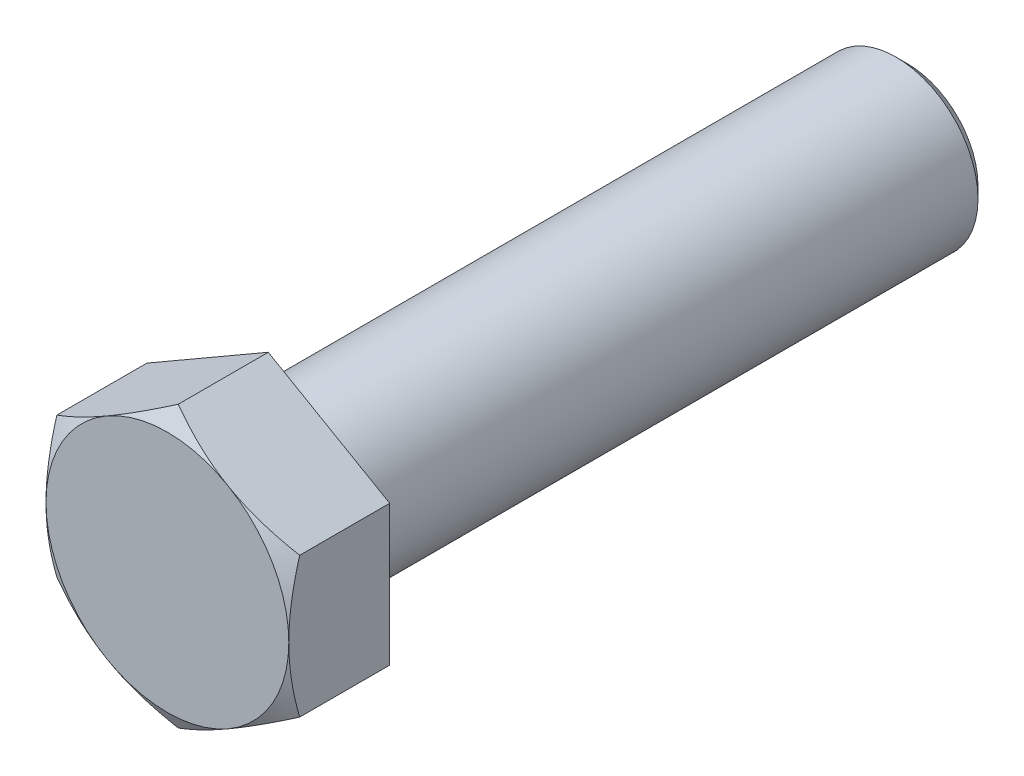
from build123d import *

# Parameters (mm, degrees)
BOSS_EXTRUDE1_DEPTH = 11.28


with BuildPart() as part:
    # Sketch1 → Boss-Extrude1 (new body)
    with BuildSketch(Plane.XY):
        Polygon((0, 15.397931679), (-13.335, 7.69896584), (-13.335, -7.69896584), (0, -15.397931679), (13.335, -7.69896584), (13.335, 7.69896584), align=None)
    extrude(amount=BOSS_EXTRUDE1_DEPTH)

    # Sketch2 → Revolve1 (revolve)
    with BuildSketch(Plane(origin=(0, 0, 0), x_dir=(0, 0, -1), z_dir=(1, 0, 0)), mode=Mode.PRIVATE) as revolve1_sk:
        with BuildLine():
            Line((0, 0), (0, 9.6))
            ThreePointArc((0, 9.6), (0.175735931, 9.175735931), (0.6, 9))
            Line((0.6, 9), (68.75, 9))
            Line((68.75, 9), (70, 7.75))
            Line((70, 7.75), (70, 0))
            Line((70, 0), (0, 0))
        make_face()
    revolve(revolve1_sk.sketch.rotate(Axis((0, 0, 0), (0, 0, -1)), 90), axis=Axis((0, 0, 0), (0, 0, -1)))

    # Sketch3 → Cut-Revolve1 (revolve, cut)
    with BuildSketch(Plane(origin=(0, 0, 0), x_dir=(0, 0, -1), z_dir=(1, 0, 0)), mode=Mode.PRIVATE) as cut_revolve1_sk:
        Polygon((-11.28, 15.397931679), (-10.08896584, 15.397931679), (-11.28, 13.335), align=None)
        Polygon((-0.2, 15.397931679), (-0.2, 12.765470054), (0, 12.65), (0, 15.397931679), align=None)
    revolve(cut_revolve1_sk.sketch.rotate(Axis((0, 0, 12.204941078), (0, 0, -1)), 90), axis=Axis((0, 0, 12.204941078), (0, 0, -1)), mode=Mode.SUBTRACT)


solid = part.part
